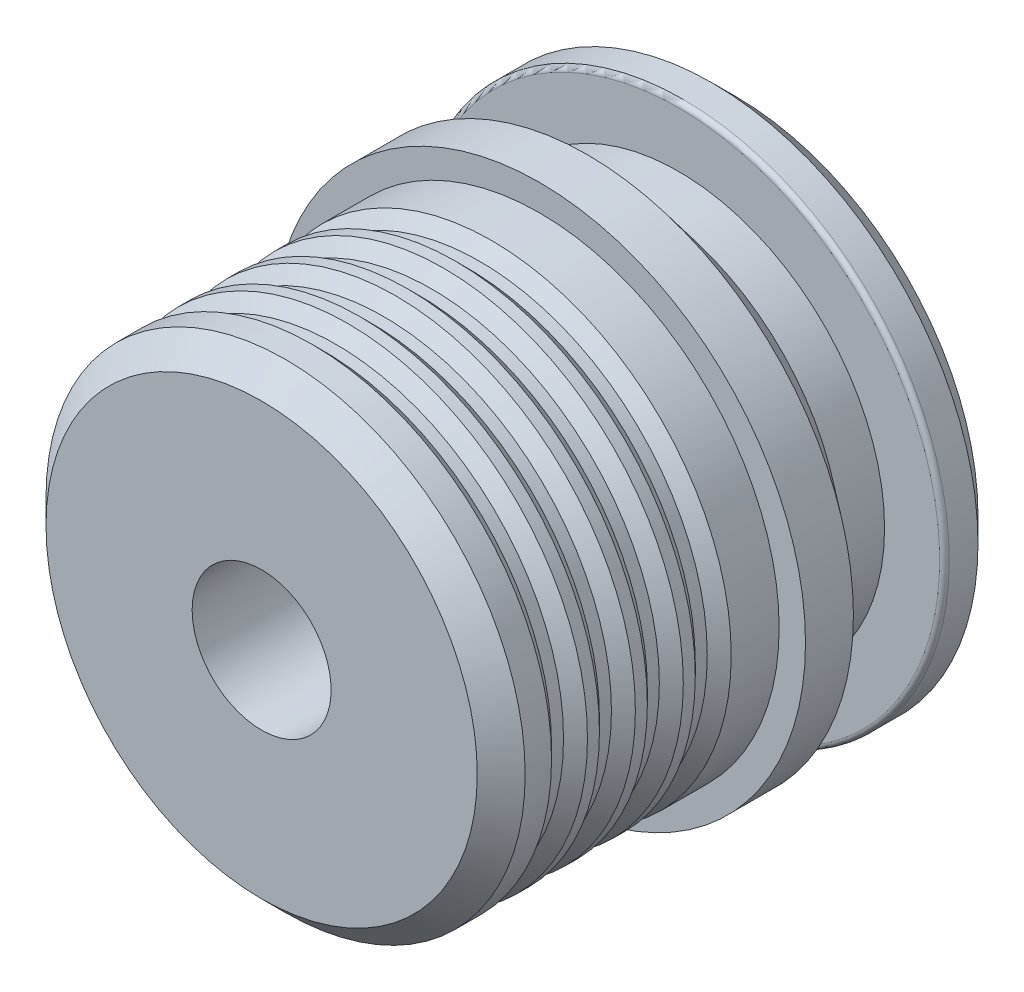
from build123d import *

# Parameters (mm, degrees)
CHAMFER_1_SIZE = 1
CHAMFER_2_SIZE = 1
FILLET_1_R     = 0.2


with BuildPart() as part:
    # 스케치3 → 회전2 (revolve)
    with BuildSketch(Plane(origin=(0, 0, 0), x_dir=(1, 0, 0), z_dir=(0, 1, 0)), mode=Mode.PRIVATE) as revolve_2_sk:
        Polygon((11.1, 0), (11.1, -2.4), (8.6, -2.4), (8.6, -4.2), (11.1, -6.2), (11.1, -8.2), (10, -8.2), (10, -10.2), (9.5, -10.7), (9.5, -11.2), (10, -11.7), (10, -12.2), (9.5, -12.7), (9.5, -13.2), (10, -13.7), (10, -14.2), (9.5, -14.7), (9.5, -15.2), (10, -15.7), (10, -16.2), (9.5, -16.7), (9.5, -17.2), (10, -17.7), (10, -19.8), (2.9, -19.8), (2.9, -11.8), (4.4, -11.8), (4.4, -10), (3.4, -10), (3.4, -8.5), (6.25, -7.736344802), (6.25, 0), align=None)
    revolve(revolve_2_sk.sketch.rotate(Axis((0, 0, 0), (0, 0, 1)), 180), axis=Axis((0, 0, 0), (0, 0, 1)))

    # 모따기1
    chamfer_1_edges = [part.edges().sort_by_distance(p)[0] for p in [
        (10, 0, 19.8),
        (6.25, 0, 0),
    ]]
    chamfer(chamfer_1_edges, length=CHAMFER_1_SIZE)

    # 모따기2
    chamfer_2_edges = [part.edges().sort_by_distance(p)[0] for p in [
        (11.1, 0, 0),
    ]]
    chamfer(chamfer_2_edges, length=CHAMFER_2_SIZE)

    # 필렛1
    fillet_1_edges = [part.edges().sort_by_distance(p)[0] for p in [
        (11.1, 0, 2.4),
    ]]
    fillet(fillet_1_edges, radius=FILLET_1_R)


solid = part.part
